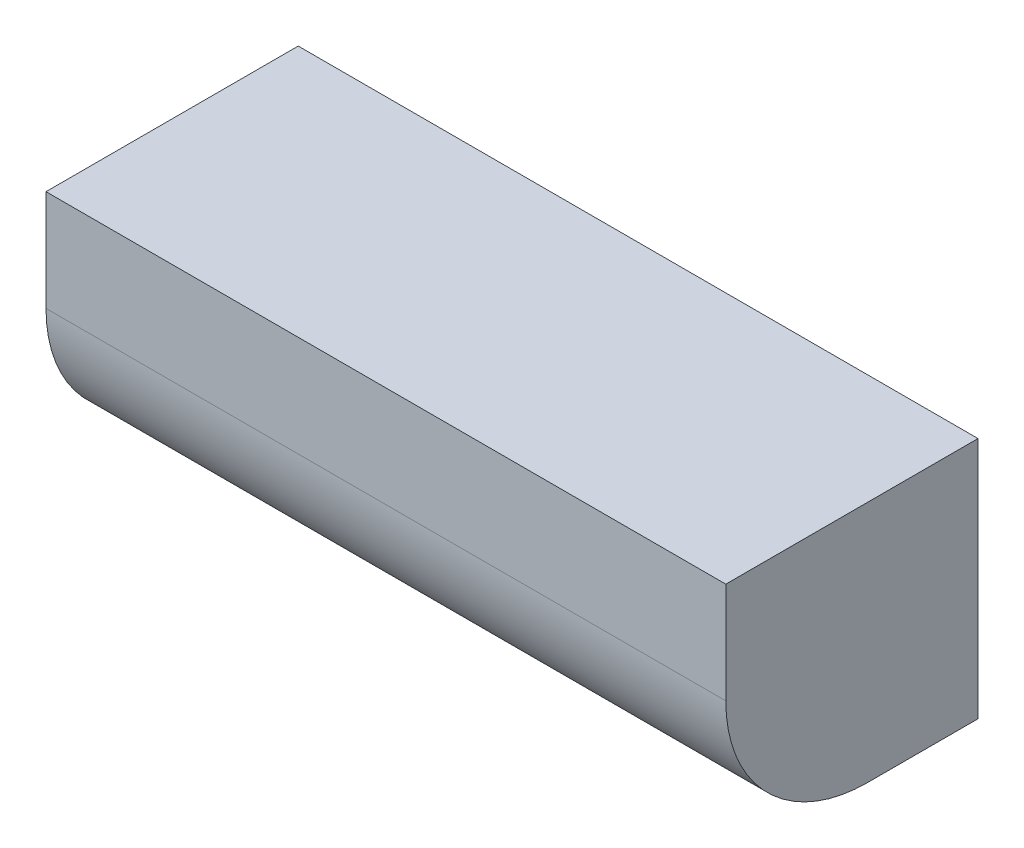
from build123d import *

# Parameters (mm, degrees)
SKETCH1_W            = 48
SKETCH1_H            = 53
BOSS_EXTRUDE1_DEPTH  = 10
SKETCH2_W            = 48
SKETCH2_H            = 5.616325
BOSS_EXTRUDE2_DEPTH  = 33.1917878
SKETCH4_W            = 4
SKETCH4_H            = 10
BOSS_EXTRUDE4_DEPTH  = 40
SKETCH5_W            = 48
SKETCH5_H            = 10.8609375
BOSS_EXTRUDE5_DEPTH  = 23.1917878
SKETCH6_W            = 48
SKETCH6_H            = 5
BOSS_EXTRUDE6_DEPTH  = 42.3
SKETCH7_W            = 12.8082122
SKETCH7_H            = 16.4772625
BOSS_EXTRUDE7_DEPTH  = 48
CUT_EXTRUDE1_REACH   = 84.426
SKETCH8_R            = 11.5
SKETCH8_R_2          = 2
FILLET1_R            = 10
FILLET2_R            = 4
SKETCH9_W            = 5
SKETCH9_H            = 16.4772625
BOSS_EXTRUDE9_DEPTH  = 48
CUT_EXTRUDE2_DEPTH   = 6
SKETCH11_R           = 1.9304
CUT_EXTRUDE3_DEPTH   = 6
BOSS_EXTRUDE11_DEPTH = 3
BOSS_EXTRUDE12_DEPTH = 48
SKETCH14_W           = 119.824941969
SKETCH14_H           = 122.237524693
CUT_EXTRUDE4_DEPTH   = 90.10667764


with BuildPart() as part:
    # Sketch1 → Boss-Extrude1 (new body)
    with BuildSketch(Plane.XY):
        with Locations((24, 26.5)):
            Rectangle(SKETCH1_W, SKETCH1_H)
    extrude(amount=BOSS_EXTRUDE1_DEPTH)

    # Sketch2 → Boss-Extrude2 (add)
    with BuildSketch(Plane(origin=(0, 0, 0), x_dir=(-1, 0, 0), z_dir=(0, 0, -1))):
        with Locations((-24, -2.8081625)):
            Rectangle(SKETCH2_W, SKETCH2_H)
    extrude(amount=-BOSS_EXTRUDE2_DEPTH)

    # Sketch4 → Boss-Extrude4 (add)
    with BuildSketch(Plane.XY.offset(10)):
        with Locations((2, 48)):
            Rectangle(SKETCH4_W, SKETCH4_H)
        with Locations((46, 48)):
            Rectangle(SKETCH4_W, SKETCH4_H)
    extrude(amount=BOSS_EXTRUDE4_DEPTH)

    # Sketch5 → Boss-Extrude5 (add)
    with BuildSketch(Plane.XY.offset(10)):
        with Locations((24, 5.43046875)):
            Rectangle(SKETCH5_W, SKETCH5_H)
    extrude(amount=BOSS_EXTRUDE5_DEPTH)

    # Sketch6 → Boss-Extrude6 (add)
    with BuildSketch(Plane.XZ.offset(5.616325)):
        with Locations((24, 30.6917878)):
            Rectangle(SKETCH6_W, SKETCH6_H)
    extrude(amount=BOSS_EXTRUDE6_DEPTH)

    # Sketch7 → Boss-Extrude7 (add)
    with BuildSketch(Plane.ZY):
        with Locations((-6.4041061, 2.62230625)):
            Rectangle(SKETCH7_W, SKETCH7_H)
    extrude(amount=-BOSS_EXTRUDE7_DEPTH)

    # Sketch8 → Cut-Extrude1 (cut, up to next)
    with BuildSketch(Plane(origin=(0, 0, 28.1917878), x_dir=(-1, 0, 0), z_dir=(0, 0, -1)), mode=Mode.PRIVATE) as cut_extrude1_sk1:
        with Locations((-24, -26.616325)):
            Circle(SKETCH8_R)
    cut_extrude1_tool1 = extrude(cut_extrude1_sk1.sketch, amount=-CUT_EXTRUDE1_REACH, mode=Mode.PRIVATE) & part.part
    # Sketch8 → Cut-Extrude1 (cut, up to next)
    with BuildSketch(Plane(origin=(0, 0, 28.1917878), x_dir=(-1, 0, 0), z_dir=(0, 0, -1)), mode=Mode.PRIVATE) as cut_extrude1_sk2:
        with Locations((-39.5, -11.116325)):
            Circle(SKETCH8_R_2)
    cut_extrude1_tool2 = extrude(cut_extrude1_sk2.sketch, amount=-CUT_EXTRUDE1_REACH, mode=Mode.PRIVATE) & part.part
    # Sketch8 → Cut-Extrude1 (cut, up to next)
    with BuildSketch(Plane(origin=(0, 0, 28.1917878), x_dir=(-1, 0, 0), z_dir=(0, 0, -1)), mode=Mode.PRIVATE) as cut_extrude1_sk3:
        with Locations((-39.5, -42.116325)):
            Circle(SKETCH8_R_2)
    cut_extrude1_tool3 = extrude(cut_extrude1_sk3.sketch, amount=-CUT_EXTRUDE1_REACH, mode=Mode.PRIVATE) & part.part
    # Sketch8 → Cut-Extrude1 (cut, up to next)
    with BuildSketch(Plane(origin=(0, 0, 28.1917878), x_dir=(-1, 0, 0), z_dir=(0, 0, -1)), mode=Mode.PRIVATE) as cut_extrude1_sk4:
        with Locations((-8.5, -11.116325)):
            Circle(SKETCH8_R_2)
    cut_extrude1_tool4 = extrude(cut_extrude1_sk4.sketch, amount=-CUT_EXTRUDE1_REACH, mode=Mode.PRIVATE) & part.part
    # Sketch8 → Cut-Extrude1 (cut, up to next)
    with BuildSketch(Plane(origin=(0, 0, 28.1917878), x_dir=(-1, 0, 0), z_dir=(0, 0, -1)), mode=Mode.PRIVATE) as cut_extrude1_sk5:
        with Locations((-8.5, -42.116325)):
            Circle(SKETCH8_R_2)
    cut_extrude1_tool5 = extrude(cut_extrude1_sk5.sketch, amount=-CUT_EXTRUDE1_REACH, mode=Mode.PRIVATE) & part.part
    add(cut_extrude1_tool1.solids().sort_by_distance((24, -26.616325, 28.191788))[0], mode=Mode.SUBTRACT)
    add(cut_extrude1_tool2.solids().sort_by_distance((39.5, -11.116325, 28.191788))[0], mode=Mode.SUBTRACT)
    add(cut_extrude1_tool3.solids().sort_by_distance((39.5, -42.116325, 28.191788))[0], mode=Mode.SUBTRACT)
    add(cut_extrude1_tool4.solids().sort_by_distance((8.5, -11.116325, 28.191788))[0], mode=Mode.SUBTRACT)
    add(cut_extrude1_tool5.solids().sort_by_distance((8.5, -42.116325, 28.191788))[0], mode=Mode.SUBTRACT)

    # Fillet1
    fillet1_edges = [part.edges().sort_by_distance(p)[0] for p in [
        (24, 10.8609375, 0),
    ]]
    fillet(fillet1_edges, radius=FILLET1_R)

    # Fillet2
    fillet2_edges = [part.edges().sort_by_distance(p)[0] for p in [
        (2, 43, 10),
        (46, 43, 10),
    ]]
    fillet(fillet2_edges, radius=FILLET2_R)

    # Sketch9 → Boss-Extrude9 (add)
    with BuildSketch(Plane(origin=(48, 0, 0), x_dir=(0, 0, -1), z_dir=(1, 0, 0))):
        with Locations((15.3082122, 2.62230625)):
            Rectangle(SKETCH9_W, SKETCH9_H)
    extrude(amount=-BOSS_EXTRUDE9_DEPTH)

    # Sketch10 → Cut-Extrude2 (cut)
    with BuildSketch(Plane.XY.offset(10)):
        Polygon((12.429, 36.979734073), (9, 38.959468146), (5.571, 36.979734073), (5.571, 33.020265927), (9, 31.040531854), (12.429, 33.020265927), align=None)
        Polygon((35.571, 36.979734073), (35.571, 33.020265927), (39, 31.040531854), (42.429, 33.020265927), (42.429, 36.979734073), (39, 38.959468146), align=None)
    extrude(amount=-CUT_EXTRUDE2_DEPTH, mode=Mode.SUBTRACT)

    # Sketch11 → Cut-Extrude3 (cut)
    with BuildSketch(Plane.XY.offset(4)):
        with Locations((9, 35)):
            Circle(SKETCH11_R)
        with Locations((39, 35)):
            Circle(SKETCH11_R)
    extrude(amount=-CUT_EXTRUDE3_DEPTH, mode=Mode.SUBTRACT)

    # Sketch12 → Boss-Extrude11 (add)
    with BuildSketch(Plane(origin=(0, 53, 0), x_dir=(1, 0, 0), z_dir=(0, 1, 0))):
        Polygon((0, 0), (0, -50), (4, -50), (4, -10), (44, -10), (44, -50), (48, -50), (48, 0), align=None)
    extrude(amount=BOSS_EXTRUDE11_DEPTH)

    # Sketch13 → Boss-Extrude12 (add)
    with BuildSketch(Plane(origin=(48, 0, 0), x_dir=(0, 0, -1), z_dir=(1, 0, 0))):
        with BuildLine():
            Line((17.8082122, 10.8609375), (10, 10.8609375))
            ThreePointArc((10, 10.8609375), (2.928932188, 13.789869688), (0, 20.8609375))
            Line((0, 20.8609375), (0, 28))
            Line((0, 28), (17.8082122, 28))
            Line((17.8082122, 28), (17.8082122, 10.8609375))
        make_face()
    extrude(amount=-BOSS_EXTRUDE12_DEPTH)

    # Sketch14 → Cut-Extrude4 (cut, through all)
    with BuildSketch(Plane(origin=(48, 0, 0), x_dir=(0, 0, -1), z_dir=(1, 0, 0))):
        with Locations((-16.90365686, 8.216937598)):
            Rectangle(SKETCH14_W, SKETCH14_H)
        with BuildLine():
            Line((0, 28), (0, 20.8609375))
            ThreePointArc((0, 20.8609375), (2.928932188, 13.789869688), (10, 10.8609375))
            Line((10, 10.8609375), (17.8082122, 10.8609375))
            Line((17.8082122, 10.8609375), (17.8082122, 28))
            Line((17.8082122, 28), (0, 28))
        make_face(mode=Mode.SUBTRACT)
    extrude(amount=-CUT_EXTRUDE4_DEPTH, mode=Mode.SUBTRACT)


solid = part.part
